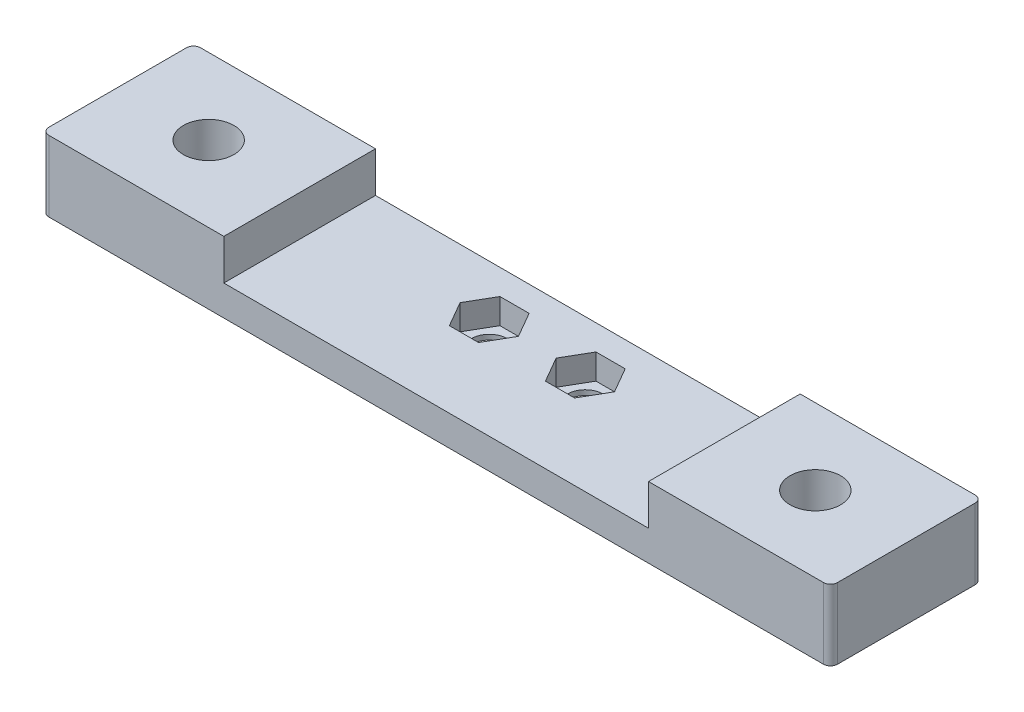
from build123d import *

# Parameters (mm, degrees)
SKETCH1_W           = 78
SKETCH1_H           = 15
SKETCH1_R           = 2.5
BOSS_EXTRUDE1_DEPTH = 3
SKETCH1_3_R         = 1.75
BOSS_EXTRUDE2_DEPTH = 0.5
FILLET1_R           = 0.7
BOSS_EXTRUDE3_START = -7
SKETCH2_R           = 2.5
BOSS_EXTRUDE3_DEPTH = 7


with BuildPart() as part:
    # Sketch1 → Boss-Extrude1 (new body)
    with BuildSketch(Plane(origin=(0, 0, 0), x_dir=(1, 0, 0), z_dir=(0, 1, 0))):
        with Locations((39, 7.5)):
            Rectangle(SKETCH1_W, SKETCH1_H)
        with Locations((9, 7.5)):
            Circle(SKETCH1_R, mode=Mode.SUBTRACT)
        Polygon((31.363249, 10), (32.806624, 12.5), (35.693376, 12.5), (37.136751, 10), (35.693376, 7.5), (32.806624, 7.5), align=None, mode=Mode.SUBTRACT)
        Polygon((42.306624, 12.5), (45.193376, 12.5), (46.636751, 10), (45.193376, 7.5), (42.306624, 7.5), (40.863249, 10), align=None, mode=Mode.SUBTRACT)
        with Locations((69, 7.5)):
            Circle(SKETCH1_R, mode=Mode.SUBTRACT)
    extrude(amount=BOSS_EXTRUDE1_DEPTH)

    # Sketch1<3> → Boss-Extrude2 (add)
    # profile 1 of 2: a face of its own
    with BuildSketch(Plane(origin=(0, 0, 0), x_dir=(1, 0, 0), z_dir=(0, 1, 0))):
        Polygon((35.693376, 12.5), (32.806624, 12.5), (31.363249, 10), (32.806624, 7.5), (35.693376, 7.5), (37.136751, 10), align=None)
        with Locations((34.25, 10)):
            Circle(SKETCH1_3_R, mode=Mode.SUBTRACT)
    # profile 2 of 2: a face of its own
    with BuildSketch(Plane(origin=(0, 0, 0), x_dir=(1, 0, 0), z_dir=(0, 1, 0))):
        Polygon((46.636751, 10), (45.193376, 12.5), (42.306624, 12.5), (40.863249, 10), (42.306624, 7.5), (45.193376, 7.5), align=None)
        with Locations((43.75, 10)):
            Circle(SKETCH1_3_R, mode=Mode.SUBTRACT)
    extrude(amount=BOSS_EXTRUDE2_DEPTH)

    # Fillet1
    fillet1_edges = [part.edges().sort_by_distance(p)[0] for p in [
        (78, 1.5, -15),
        (78, 1.5, 0),
        (0, 1.5, 0),
        (0, 1.5, -15),
    ]]
    fillet(fillet1_edges, radius=FILLET1_R)

    # Sketch2 → Boss-Extrude3 (add)
    # profile 1 of 2: a face of its own
    with BuildSketch(Plane(origin=(0, 0, 0), x_dir=(-1, 0, 0), z_dir=(0, -1, 0)).offset(BOSS_EXTRUDE3_START)):
        with BuildLine():
            Line((-77.3, 0), (-60, 0))
            Line((-60, 0), (-60, 15))
            Line((-60, 15), (-77.3, 15))
            ThreePointArc((-77.3, 15), (-77.794975, 14.794975), (-78, 14.3))
            Line((-78, 14.3), (-78, 0.7))
            ThreePointArc((-78, 0.7), (-77.794975, 0.205025), (-77.3, 0))
        make_face()
        with Locations((-69, 7.5)):
            Circle(SKETCH2_R, mode=Mode.SUBTRACT)
    # profile 2 of 2: a face of its own
    with BuildSketch(Plane(origin=(0, 0, 0), x_dir=(-1, 0, 0), z_dir=(0, -1, 0)).offset(BOSS_EXTRUDE3_START)):
        with BuildLine():
            Line((-18, 15), (-18, 0))
            Line((-18, 0), (-0.7, 0))
            ThreePointArc((-0.7, 0), (-0.205025, 0.205025), (0, 0.7))
            Line((0, 0.7), (0, 14.3))
            ThreePointArc((0, 14.3), (-0.205025, 14.794975), (-0.7, 15))
            Line((-0.7, 15), (-18, 15))
        make_face()
        with Locations((-9, 7.5)):
            Circle(SKETCH2_R, mode=Mode.SUBTRACT)
    extrude(amount=BOSS_EXTRUDE3_DEPTH)


solid = part.part
